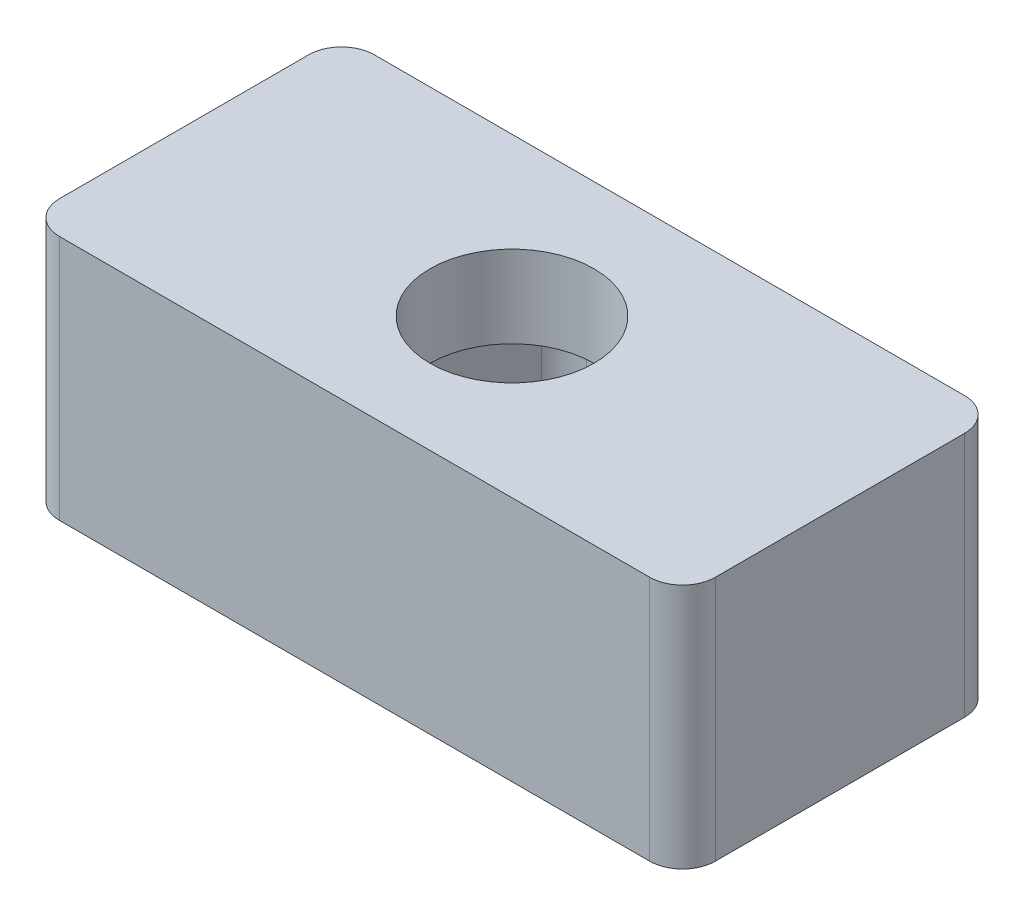
from build123d import *

# Parameters (mm, degrees)
SKETCH1_W           = 20
SKETCH1_H           = 9.6
BOSS_EXTRUDE1_DEPTH = 5
SKETCH2_W           = 20
SKETCH2_H           = 9.6
SKETCH2_R           = 2.5
BOSS_EXTRUDE2_DEPTH = 2.5
FILLET1_R           = 1


with BuildPart() as part:
    # Sketch1 → Boss-Extrude1 (new body)
    with BuildSketch(Plane(origin=(0, 0, 0), x_dir=(1, 0, 0), z_dir=(0, 1, 0))):
        Rectangle(SKETCH1_W, SKETCH1_H)
        Polygon((4.618802154, 0), (2.309401077, 4), (-2.309401077, 4), (-4.618802154, 0), (-2.309401077, -4), (2.309401077, -4), align=None, mode=Mode.SUBTRACT)
    extrude(amount=BOSS_EXTRUDE1_DEPTH)

    # Sketch2 → Boss-Extrude2 (add)
    with BuildSketch(Plane(origin=(0, 5, 0), x_dir=(1, 0, 0), z_dir=(0, 1, 0))):
        Rectangle(SKETCH2_W, SKETCH2_H)
        with Locations(Location((0, 0, 0), (0, 0, 270))):
            Circle(SKETCH2_R, mode=Mode.SUBTRACT)
    extrude(amount=BOSS_EXTRUDE2_DEPTH)

    # Fillet1
    fillet1_edges = [part.edges().sort_by_distance(p)[0] for p in [
        (2.309401077, 2.5, 4),
        (4.618802154, 2.5, 0),
        (2.309401077, 2.5, -4),
        (-2.309401077, 2.5, -4),
        (-4.618802154, 2.5, 0),
        (-2.309401077, 2.5, 4),
        (10, 3.75, 4.8),
        (-10, 3.75, 4.8),
        (-10, 3.75, -4.8),
        (10, 3.75, -4.8),
    ]]
    fillet(fillet1_edges, radius=FILLET1_R)


solid = part.part
